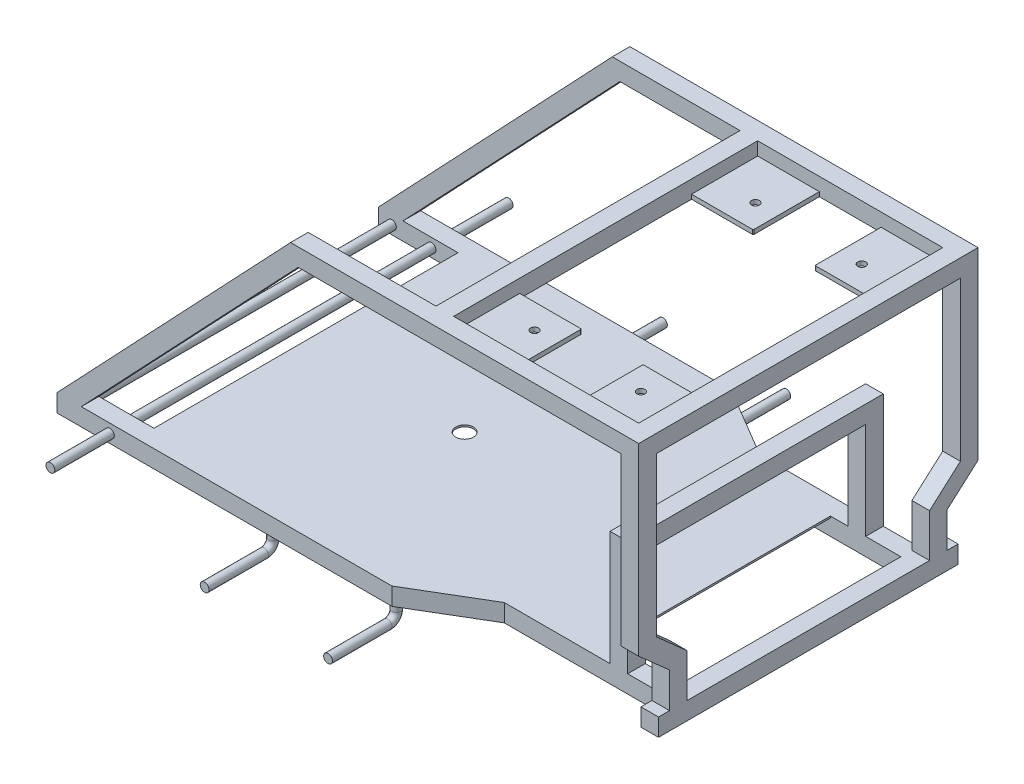
from build123d import *

# Parameters (mm, degrees)
BOSS_EXTRUDE1_DEPTH = 10
SKETCH2_R           = 5
SKETCH2_W           = 20
SKETCH2_H           = 20
BOSS_EXTRUDE2_DEPTH = 175
SKETCH3_R           = 5
BOSS_EXTRUDE3_DEPTH = 260
SKETCH4_R           = 5
SKETCH5_W           = 30
SKETCH5_H           = 20
CUT_EXTRUDE1_DEPTH  = 20
SKETCH6_W           = 55
SKETCH6_H           = 250
BOSS_EXTRUDE4_DEPTH = 2
SKETCH7_R           = 10
CUT_EXTRUDE2_DEPTH  = 30
SKETCH8_W           = 20
SKETCH8_H           = 150
BOSS_EXTRUDE5_DEPTH = 145
SKETCH9_W           = 250
SKETCH9_H           = 130
CUT_EXTRUDE3_DEPTH  = 20
SKETCH10_W          = 25
SKETCH10_H          = 20
BOSS_EXTRUDE6_DEPTH = 20
BOSS_EXTRUDE7_DEPTH = 20
SKETCH14_W          = 20
SKETCH14_H          = 20
BOSS_EXTRUDE8_DEPTH = 175
SKETCH15_R          = 4.5
BOSS_EXTRUDE9_DEPTH = 5


with BuildPart() as part:
    # Sketch1 → Boss-Extrude1 (new, symmetric)
    with BuildSketch(Plane(origin=(0, 0, 0), x_dir=(1, 0, 0), z_dir=(0, 1, 0))):
        Polygon((-330, 192.5), (50, 192.5), (130, 145), (330, 145), (330, 125), (330, -125), (330, -145), (130, -145), (50, -192.5), (-330, -192.5), (-330, -172.5), (44.50990723, -172.5), (124.50990723, -125), (310, -125), (310, 125), (124.50990723, 125), (44.50990723, 172.5), (-330, 172.5), align=None)
    extrude(amount=BOSS_EXTRUDE1_DEPTH, both=True)

    # Sketch2 → Boss-Extrude2 (add, symmetric)
    with BuildSketch(Plane.XY):
        with Locations(Location((-315, 0, 0), (0, 0, 180))):
            Circle(SKETCH2_R)
        with Locations((-230, 0)):
            Rectangle(SKETCH2_W, SKETCH2_H)
        with Locations((165, 0)):
            Rectangle(SKETCH2_W, SKETCH2_H)
    extrude(amount=BOSS_EXTRUDE2_DEPTH, both=True)

    # Sketch3 → Boss-Extrude3 (add, symmetric)
    with BuildSketch(Plane.XY):
        with Locations((-270, 0)):
            Circle(SKETCH3_R)
    extrude(amount=BOSS_EXTRUDE3_DEPTH, both=True)

    # Sweep1: sweep along a curve in space
    with BuildLine() as sweep1_path:
        Line((-95, -10, 182.5), (-95, -20, 182.5))
        ThreePointArc((-95, -20, 182.5), (-95, -27.071067812, 185.428932188), (-95, -30, 192.5))
        Line((-95, -30, 192.5), (-95, -30, 260))
    # Sketch4 → Sweep1 (sweep)
    with BuildSketch(Plane.XZ.offset(10)):
        with Locations((-95, 182.5)):
            Circle(SKETCH4_R)
        with Locations((45, 182.5)):
            Circle(SKETCH4_R)
    sweep1 = sweep(path=sweep1_path.line)

    # Mirror1: Sweep1 across plane
    add(sweep1.mirror(Plane.XY))

    # Sketch5 → Cut-Extrude1 (cut)
    with BuildSketch(Plane(origin=(175, 0, 0), x_dir=(0, 0, -1), z_dir=(1, 0, 0))):
        with Locations((-160, 0)):
            Rectangle(SKETCH5_W, SKETCH5_H)
        with Locations((160, 0)):
            Rectangle(SKETCH5_W, SKETCH5_H)
    extrude(amount=-CUT_EXTRUDE1_DEPTH, mode=Mode.SUBTRACT)

    # Sketch6 → Boss-Extrude4 (add)
    with BuildSketch(Plane(origin=(0, 10, 0), x_dir=(1, 0, 0), z_dir=(0, 1, 0))):
        Polygon((-220, -172.5), (-220, 172.5), (44.50990723, 172.5), (124.50990723, 125), (155, 125), (155, -125), (124.50990723, -125), (44.50990723, -172.5), align=None)
        with Locations((202.5, 0)):
            Rectangle(SKETCH6_W, SKETCH6_H)
    extrude(amount=-BOSS_EXTRUDE4_DEPTH)

    # Sketch7 → Cut-Extrude2 (cut)
    with BuildSketch(Plane(origin=(0, 10, 0), x_dir=(1, 0, 0), z_dir=(0, 1, 0))):
        with Locations(Location((-60, 0, 0), (0, 0, 270))):
            Circle(SKETCH7_R)
    extrude(amount=-CUT_EXTRUDE2_DEPTH, mode=Mode.SUBTRACT)

    # Sketch8 → Boss-Extrude5 (add, symmetric)
    with BuildSketch(Plane.XY):
        with Locations((260, 65)):
            Rectangle(SKETCH8_W, SKETCH8_H)
    extrude(amount=BOSS_EXTRUDE5_DEPTH, both=True)

    # Sketch9 → Cut-Extrude3 (cut)
    with BuildSketch(Plane(origin=(270, 0, 0), x_dir=(0, 0, -1), z_dir=(1, 0, 0))):
        with Locations((0, 55)):
            Rectangle(SKETCH9_W, SKETCH9_H)
    extrude(amount=-CUT_EXTRUDE3_DEPTH, mode=Mode.SUBTRACT)

    # Sketch10 → Boss-Extrude6 (add)
    with BuildSketch(Plane(origin=(330, 0, 0), x_dir=(0, 0, -1), z_dir=(1, 0, 0))):
        Polygon((-157.5, 10), (-157.5, 50), (-192.5, 80.996688705), (-192.5, 290), (192.5, 290), (192.5, 80.996688705), (157.5, 50), (157.5, 10), (137.5, 10), (137.5, 59.003311295), (172.5, 90), (172.5, 270), (-172.5, 270), (-172.5, 90), (-137.5, 59.003311295), (-137.5, 10), align=None)
        with Locations((157.5, 0)):
            Rectangle(SKETCH10_W, SKETCH10_H)
        with Locations((-157.5, 0)):
            Rectangle(SKETCH10_W, SKETCH10_H)
    extrude(amount=-BOSS_EXTRUDE6_DEPTH)

    # Sketch13 → Boss-Extrude7 (add)
    with BuildSketch(Plane(origin=(0, 0, -192.5), x_dir=(-1, 0, 0), z_dir=(0, 0, -1))):
        Polygon((-310, 290), (65, 290), (330, 10), (302.462919248, 10), (56.391490677, 270), (-310, 270), align=None)
    boss_extrude7 = extrude(amount=-BOSS_EXTRUDE7_DEPTH)

    # Mirror2: Boss-Extrude7 across plane
    add(boss_extrude7.mirror(Plane.XY))

    # Sketch14 → Boss-Extrude8 (add, symmetric)
    with BuildSketch(Plane.XY):
        with Locations((90, 280)):
            Rectangle(SKETCH14_W, SKETCH14_H)
    extrude(amount=BOSS_EXTRUDE8_DEPTH, both=True)

    # Sketch15 → Boss-Extrude9 (add)
    # profile 1 of 4: a face of its own
    with BuildSketch(Plane(origin=(0, 270, 0), x_dir=(-1, 0, 0), z_dir=(0, -1, 0))):
        with BuildLine():
            Line((-310, 97.5), (-241, 97.5))
            ThreePointArc((-241, 97.5), (-240.292893219, 97.792893219), (-240, 98.5))
            Line((-240, 98.5), (-240, 172.5))
            Line((-240, 172.5), (-310, 172.5))
            Line((-310, 172.5), (-310, 97.5))
        make_face()
        with Locations(Location((-265.332009498, 125.279552898, 0), (0, 0, 270))):
            Circle(SKETCH15_R, mode=Mode.SUBTRACT)
    # profile 2 of 4: a face of its own
    with BuildSketch(Plane(origin=(0, 270, 0), x_dir=(-1, 0, 0), z_dir=(0, -1, 0))):
        with BuildLine():
            Line((-100, 172.5), (-170, 172.5))
            Line((-170, 172.5), (-170, 98.5))
            ThreePointArc((-170, 98.5), (-169.707106781, 97.792893219), (-169, 97.5))
            Line((-169, 97.5), (-100, 97.5))
            Line((-100, 97.5), (-100, 172.5))
        make_face()
        with Locations(Location((-144.667990502, 125.279552898, 0), (0, 0, 90))):
            Circle(SKETCH15_R, mode=Mode.SUBTRACT)
    # profile 3 of 4: a face of its own
    with BuildSketch(Plane(origin=(0, 270, 0), x_dir=(-1, 0, 0), z_dir=(0, -1, 0))):
        with BuildLine():
            Line((-310, -172.5), (-310, -97.5))
            Line((-310, -97.5), (-241, -97.5))
            ThreePointArc((-241, -97.5), (-240.292893219, -97.792893219), (-240, -98.5))
            Line((-240, -98.5), (-240, -172.5))
            Line((-240, -172.5), (-310, -172.5))
        make_face()
        with Locations(Location((-265.332009498, -125.279552898, 0), (0, 0, 90))):
            Circle(SKETCH15_R, mode=Mode.SUBTRACT)
    # profile 4 of 4: a face of its own
    with BuildSketch(Plane(origin=(0, 270, 0), x_dir=(-1, 0, 0), z_dir=(0, -1, 0))):
        with BuildLine():
            Line((-100, -97.5), (-169, -97.5))
            ThreePointArc((-169, -97.5), (-169.707106781, -97.792893219), (-170, -98.5))
            Line((-170, -98.5), (-170, -172.5))
            Line((-170, -172.5), (-100, -172.5))
            Line((-100, -172.5), (-100, -97.5))
        make_face()
        with Locations(Location((-144.667990502, -125.279552898, 0), (0, 0, 270))):
            Circle(SKETCH15_R, mode=Mode.SUBTRACT)
    extrude(amount=-BOSS_EXTRUDE9_DEPTH)


solid = part.part
